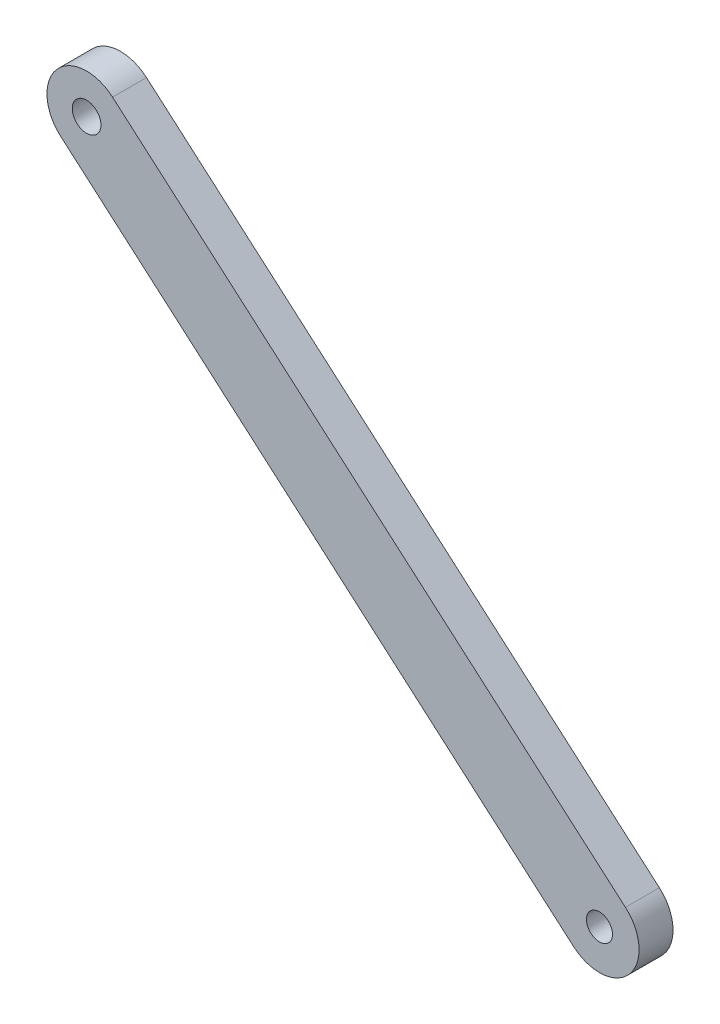
from build123d import *

# Parameters (mm, degrees)
ESQUISSE1_R        = 1.149987874
ESQUISSE1_R_2      = 1.268103094
BOSS_EXTRU_1_DEPTH = 3


with BuildPart() as part:
    # Esquisse1 → Boss.-Extru.1 (new body)
    with BuildSketch(Plane.XY):
        with BuildLine():
            Line((17.009802299, -24.770543396), (-28.300620937, 14.560939492))
            ThreePointArc((-28.300620937, 14.560939492), (-28.649392457, 19.498384016), (-23.711947934, 19.847155536))
            Line((-23.711947934, 19.847155536), (21.598475302, -19.484327352))
            ThreePointArc((21.598475302, -19.484327352), (21.947246823, -24.421771876), (17.009802299, -24.770543396))
        make_face()
        with Locations((19.304138801, -22.127435374)):
            Circle(ESQUISSE1_R, mode=Mode.SUBTRACT)
        with Locations((-26.006284435, 17.204047514)):
            Circle(ESQUISSE1_R_2, mode=Mode.SUBTRACT)
    extrude(amount=BOSS_EXTRU_1_DEPTH)


solid = part.part
